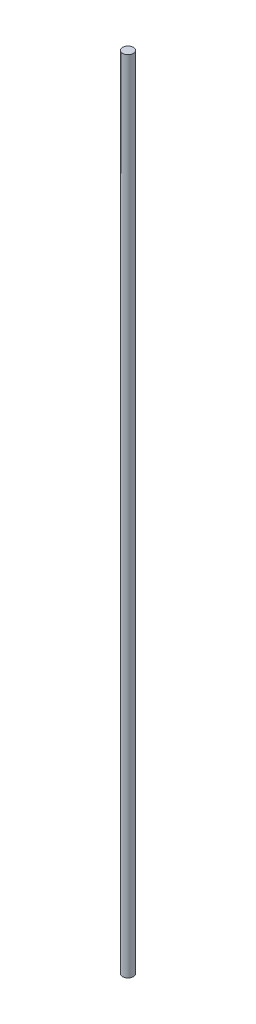
from build123d import *

# Parameters (mm, degrees)
ESQUISSE1_R        = 1
BOSS_EXTRU_1_DEPTH = 150


with BuildPart() as part:
    # Esquisse1 → Boss.-Extru.1 (new body)
    with BuildSketch(Plane(origin=(0, 0, 0), x_dir=(1, 0, 0), z_dir=(0, 1, 0))):
        with Locations(Location((-18.938989748, 21.606453093, 0), (0, 0, 270))):
            Circle(ESQUISSE1_R)
    extrude(amount=BOSS_EXTRU_1_DEPTH)


solid = part.part
